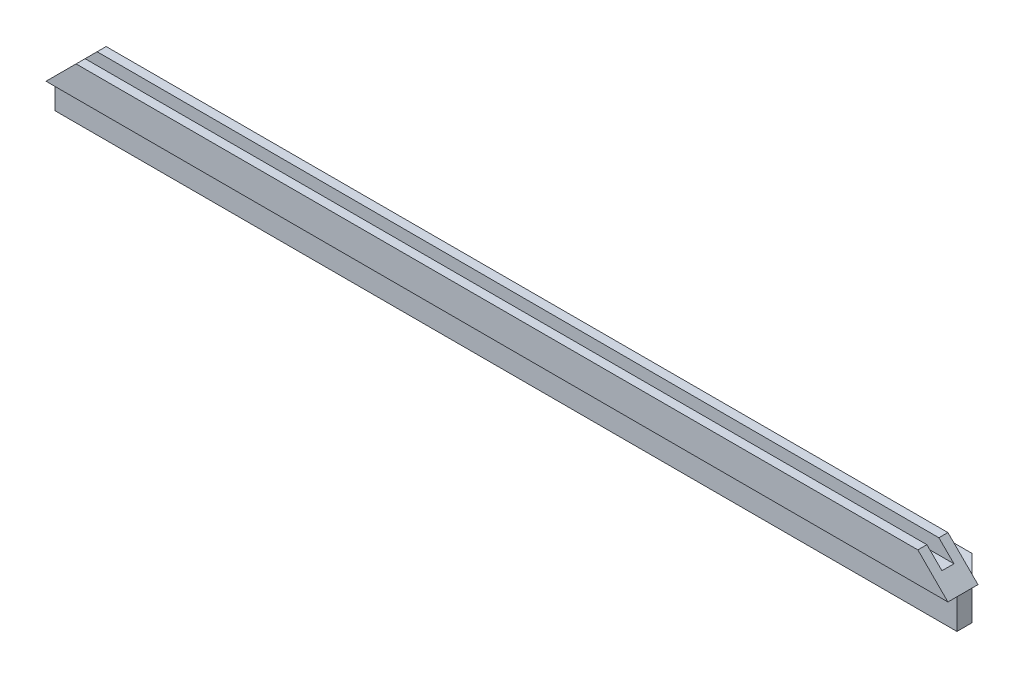
from build123d import *

# Parameters (mm, degrees)
EXTRUDE_2_DEPTH = 4
EXTRUDE_3_DEPTH = 3
SKETCH_5_W      = 300
SKETCH_5_H      = 10
EXTRUDE_4_DEPTH = 5
EXTRUDE_5_DEPTH = 4
EXTRUDE_6_DEPTH = 3


with BuildPart() as part:
    # 草图2 → 凸台-拉伸2 (new body)
    with BuildSketch(Plane(origin=(0, 0, 0), x_dir=(1, 0, 0), z_dir=(0, 1, 0))):
        Polygon((-130.641446974, -36.925945051), (169.358553026, -36.925945051), (164.358553026, -31.925945051), (-125.641446974, -31.925945051), align=None)
    extrude(amount=EXTRUDE_2_DEPTH)

    # 草图3 → 凸台-拉伸3 (add)
    with BuildSketch(Plane(origin=(0, 4, 0), x_dir=(1, 0, 0), z_dir=(0, 1, 0))):
        Polygon((-130.641446974, -36.925945051), (-120.641446974, -26.925945051), (159.358553026, -26.925945051), (169.358553026, -36.925945051), align=None)
    extrude_3 = extrude(amount=EXTRUDE_3_DEPTH)

    # 镜向1: 凸台-拉伸3 across plane
    add(extrude_3.mirror(Plane.ZX.offset(2)))

    # 草图5 → 凸台-拉伸4 (add)
    with BuildSketch(Plane.XY.offset(36.925945051)):
        with Locations((19.358553026, 2)):
            Rectangle(SKETCH_5_W, SKETCH_5_H)
    extrude(amount=EXTRUDE_4_DEPTH)

    # 草图7 → 凸台-拉伸5 (add)
    with BuildSketch(Plane.XY.offset(41.925945051)):
        Polygon((-130.641446974, 7), (169.358553026, 7), (164.358553026, 12), (-125.641446974, 12), align=None)
    extrude(amount=-EXTRUDE_5_DEPTH)

    # 草图8 → 凸台-拉伸6 (add)
    with BuildSketch(Plane(origin=(0, 0, 37.925945051), x_dir=(-1, 0, 0), z_dir=(0, 0, -1))):
        Polygon((-169.358553026, 7), (-159.358553026, 17), (120.641446974, 17), (130.641446974, 7), align=None)
    extrude_6 = extrude(amount=EXTRUDE_6_DEPTH)

    # 镜向2: 凸台-拉伸6 across plane
    add(extrude_6.mirror(Plane(origin=(0, 0, 39.925945051), x_dir=(1, 0, 0), z_dir=(0, 0, -1))))


solid = part.part
